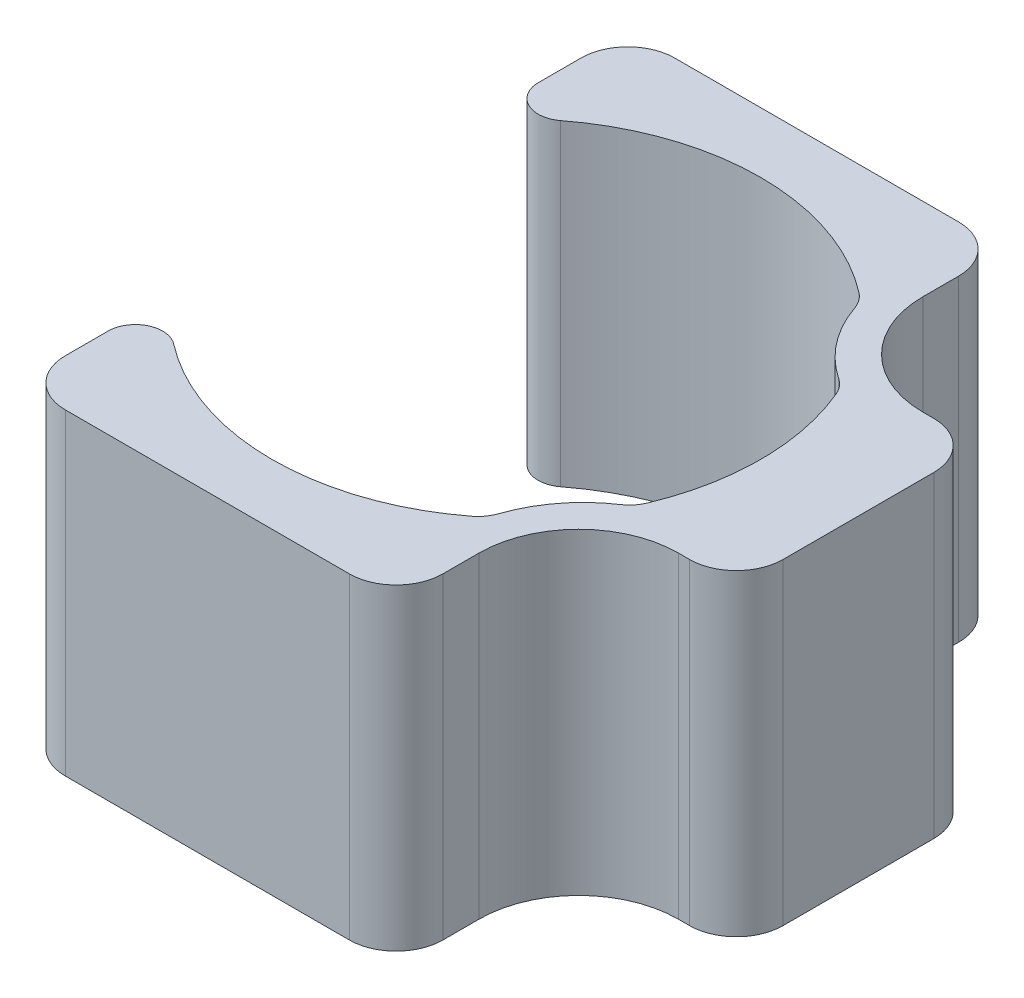
from build123d import *

# Parameters (mm, degrees)
BOSS_EXTRUDE1_DEPTH = 101.6


with BuildPart() as part:
    # Sketch1 → Boss-Extrude1 (new body)
    with BuildSketch(Plane(origin=(0, 0, 0), x_dir=(1, 0, 0), z_dir=(0, 1, 0))):
        with BuildLine():
            Line((-61.89337695, 68.904893678), (-61.89337695, 82.620893678))
            ThreePointArc((-61.89337695, 82.620893678), (-57.499978668, 93.227495396), (-46.89337695, 97.620893678))
            Line((-46.89337695, 97.620893678), (44.10662305, 97.620893678))
            ThreePointArc((44.10662305, 97.620893678), (54.713224768, 93.227495396), (59.10662305, 82.620893678))
            Line((59.10662305, 82.620893678), (59.10662305, 71.13235))
            ThreePointArc((59.10662305, 71.13235), (68.479206052, 48.504933002), (91.10662305, 39.13235))
            Line((91.10662305, 39.13235), (94.60662305, 39.13235))
            ThreePointArc((94.60662305, 39.13235), (105.213224768, 34.738951718), (109.60662305, 24.13235))
            Line((109.60662305, 24.13235), (109.60662305, -24.13235))
            ThreePointArc((109.60662305, -24.13235), (105.213224768, -34.738951718), (94.60662305, -39.13235))
            Line((94.60662305, -39.13235), (91.10662305, -39.13235))
            ThreePointArc((91.10662305, -39.13235), (68.479206052, -48.504933002), (59.10662305, -71.13235))
            Line((59.10662305, -71.13235), (59.10662305, -82.620893678))
            ThreePointArc((59.10662305, -82.620893678), (54.713224768, -93.227495396), (44.10662305, -97.620893678))
            Line((44.10662305, -97.620893678), (-46.89337695, -97.620893678))
            ThreePointArc((-46.89337695, -97.620893678), (-57.499978668, -93.227495396), (-61.89337695, -82.620893678))
            Line((-61.89337695, -82.620893678), (-61.89337695, -68.904893678))
            ThreePointArc((-61.89337695, -68.904893678), (-57.006333295, -61.056893678), (-47.807345705, -61.98043415))
            ThreePointArc((-47.807345705, -61.98043415), (1.776e-06, -78.2759), (47.807348518, -61.98043198))
            ThreePointArc((47.807348518, -61.98043198), (49.925699103, -59.785267241), (51.321425315, -57.072684381))
            ThreePointArc((51.321425315, -57.072684381), (58.006985995, -44.607187443), (68.337697819, -34.944800122))
            ThreePointArc((68.337697819, -34.944800122), (70.600912289, -32.899312969), (72.178496552, -30.288300651))
            ThreePointArc((72.178496552, -30.288300651), (78.2759, -7.06e-07), (72.178497098, 30.288299349))
            ThreePointArc((72.178497098, 30.288299349), (70.600912642, 32.899311988), (68.337697819, 34.94479931))
            ThreePointArc((68.337697819, 34.94479931), (58.006984392, 44.607187472), (51.321422969, 57.072685993))
            ThreePointArc((51.321422969, 57.072685993), (49.92569661, 59.785269199), (47.807345705, 61.98043415))
            ThreePointArc((47.807345705, 61.98043415), (0, 78.2759), (-47.807345705, 61.98043415))
            ThreePointArc((-47.807345705, 61.98043415), (-57.006333295, 61.056893678), (-61.89337695, 68.904893678))
        make_face()
    extrude(amount=BOSS_EXTRUDE1_DEPTH)


solid = part.part
